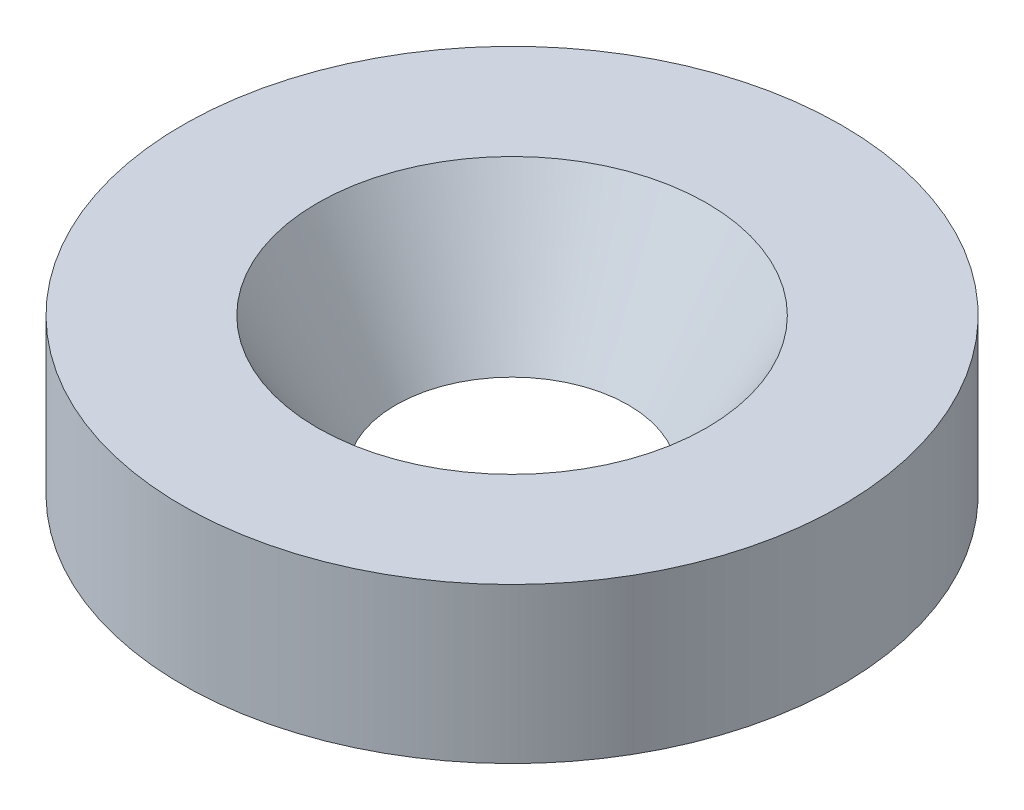
from build123d import *


with BuildPart() as part:
    # Sketch1 → Revolve1 (revolve)
    with BuildSketch(Plane.XY, mode=Mode.PRIVATE) as revolve1_sk:
        Polygon((8.5, 0), (8.5, 4), (5.020725942, 4), (3, 0.5), (6, 0.5), (6, 2.75), (8, 2.75), (8, 0), align=None)
    revolve(revolve1_sk.sketch.rotate(Axis((0, 0, 0), (0, 1, 0)), 90), axis=Axis((0, 0, 0), (0, 1, 0)))


solid = part.part
